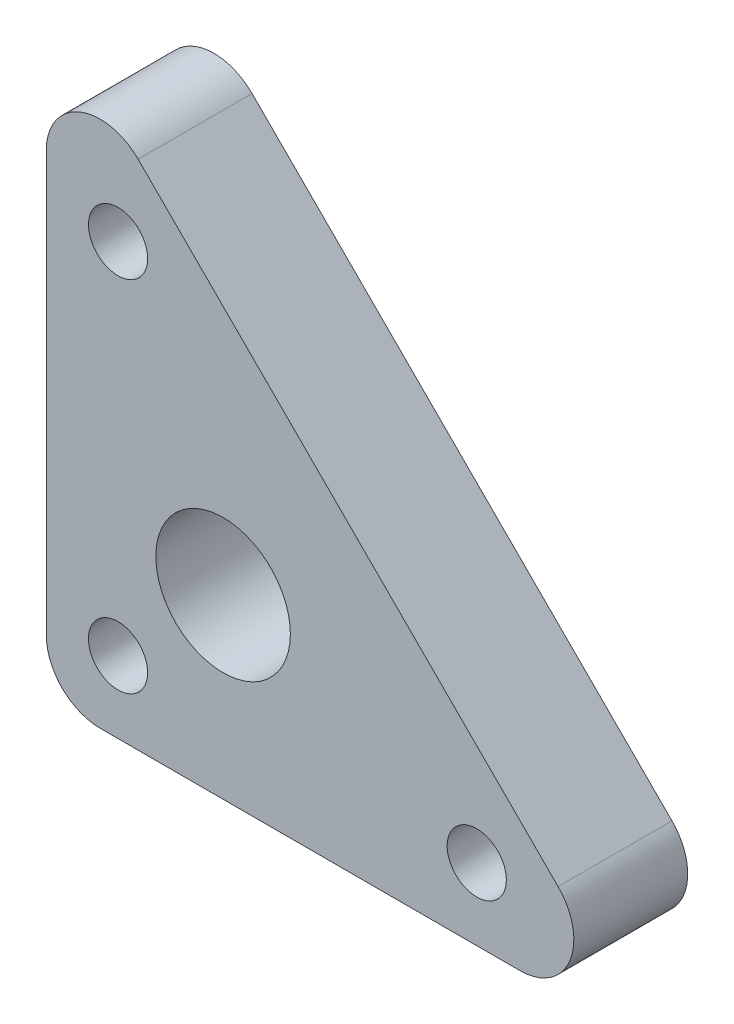
from build123d import *

# Parameters (mm, degrees)
SKETCH1_R           = 1.65
SKETCH1_R_2         = 3.75
BOSS_EXTRUDE1_DEPTH = 6.35
FILLET1_R           = 3


with BuildPart() as part:
    # Sketch1 → Boss-Extrude1 (new body)
    with BuildSketch(Plane.XY):
        Polygon((-4, 29.656854249), (29.656854249, -4), (-4, -4), align=None)
        with Locations((0, 20)):
            Circle(SKETCH1_R, mode=Mode.SUBTRACT)
        with Locations((20, 0)):
            Circle(SKETCH1_R, mode=Mode.SUBTRACT)
        Circle(SKETCH1_R, mode=Mode.SUBTRACT)
        with Locations((5.857864376, 5.857864376)):
            Circle(SKETCH1_R_2, mode=Mode.SUBTRACT)
    extrude(amount=BOSS_EXTRUDE1_DEPTH)

    # Fillet1
    fillet1_edges = [part.edges().sort_by_distance(p)[0] for p in [
        (-4, 29.656854249, 3.175),
        (29.656854249, -4, 3.175),
        (-4, -4, 3.175),
    ]]
    fillet(fillet1_edges, radius=FILLET1_R)


solid = part.part
